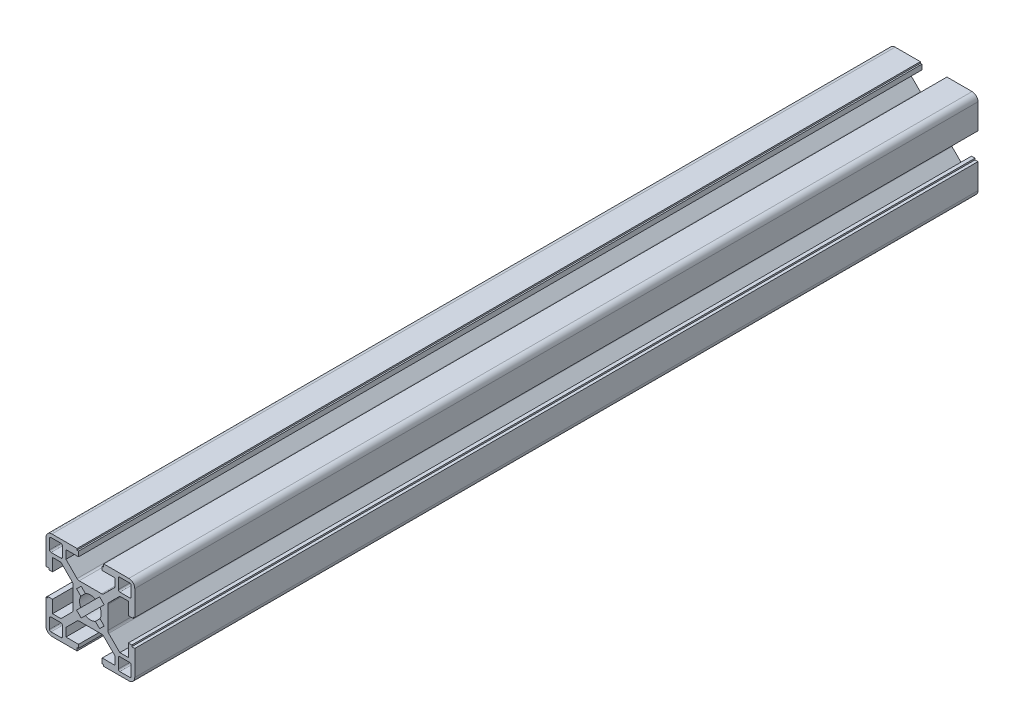
from build123d import *

# Parameters (mm, degrees)
BOSS_EXTRUDE1_DEPTH = 285


with BuildPart() as part:
    # Sketch1 → Boss-Extrude1 (new body)
    with BuildSketch(Plane.XY):
        with BuildLine():
            Line((-4.5, 14.5), (-4.5, 15))
            Line((-4.5, 15), (-13, 15))
            ThreePointArc((-13, 15), (-14.414213562, 14.414213562), (-15, 13))
            Line((-15, 13), (-15, 4.5))
            Line((-15, 4.5), (-14, 4.5))
            Line((-14, 4.5), (-14, 4))
            Line((-14, 4), (-12.8, 4))
            Line((-12.8, 4), (-12.8, 8.25))
            Line((-12.8, 8.25), (-9.95, 8.25))
            Line((-9.95, 8.25), (-6.192893219, 4.492893219))
            ThreePointArc((-6.192893219, 4.492893219), (-5.976120467, 4.16846987), (-5.9, 3.785786438))
            Line((-5.9, 3.785786438), (-5.9, -3.785786438))
            ThreePointArc((-5.9, -3.785786438), (-5.976120467, -4.16846987), (-6.192893219, -4.492893219))
            Line((-6.192893219, -4.492893219), (-9.95, -8.25))
            Line((-9.95, -8.25), (-12.8, -8.25))
            Line((-12.8, -8.25), (-12.8, -4))
            Line((-12.8, -4), (-14.5, -4))
            Line((-14.5, -4), (-14.5, -4.5))
            Line((-14.5, -4.5), (-15, -4.5))
            Line((-15, -4.5), (-15, -13))
            ThreePointArc((-15, -13), (-14.414213562, -14.414213562), (-13, -15))
            Line((-13, -15), (-4.5, -15))
            Line((-4.5, -15), (-4.5, -14))
            Line((-4.5, -14), (-4, -14))
            Line((-4, -14), (-4, -12.8))
            Line((-4, -12.8), (-8.25, -12.8))
            Line((-8.25, -12.8), (-8.25, -9.95))
            Line((-8.25, -9.95), (-4.492893219, -6.192893219))
            ThreePointArc((-4.492893219, -6.192893219), (-4.16846987, -5.976120467), (-3.785786438, -5.9))
            Line((-3.785786438, -5.9), (3.785786438, -5.9))
            ThreePointArc((3.785786438, -5.9), (4.16846987, -5.976120467), (4.492893219, -6.192893219))
            Line((4.492893219, -6.192893219), (8.25, -9.95))
            Line((8.25, -9.95), (8.25, -12.8))
            Line((8.25, -12.8), (4, -12.8))
            Line((4, -12.8), (4, -14.5))
            Line((4, -14.5), (4.5, -14.5))
            Line((4.5, -14.5), (4.5, -15))
            Line((4.5, -15), (13, -15))
            ThreePointArc((13, -15), (14.414213562, -14.414213562), (15, -13))
            Line((15, -13), (15, -4.5))
            Line((15, -4.5), (14, -4.5))
            Line((14, -4.5), (14, -4))
            Line((14, -4), (12.8, -4))
            Line((12.8, -4), (12.8, -8.25))
            Line((12.8, -8.25), (9.95, -8.25))
            Line((9.95, -8.25), (6.192893219, -4.492893219))
            ThreePointArc((6.192893219, -4.492893219), (5.976120467, -4.16846987), (5.9, -3.785786438))
            Line((5.9, -3.785786438), (5.9, 3.785786438))
            ThreePointArc((5.9, 3.785786438), (5.976120467, 4.16846987), (6.192893219, 4.492893219))
            Line((6.192893219, 4.492893219), (9.95, 8.25))
            Line((9.95, 8.25), (12.8, 8.25))
            Line((12.8, 8.25), (12.8, 4))
            Line((12.8, 4), (14.5, 4))
            Line((14.5, 4), (14.5, 4.5))
            Line((14.5, 4.5), (15, 4.5))
            Line((15, 4.5), (15, 13))
            ThreePointArc((15, 13), (14.414213562, 14.414213562), (13, 15))
            Line((13, 15), (4.5, 15))
            Line((4.5, 15), (4.5, 14))
            Line((4.5, 14), (4, 14))
            Line((4, 14), (4, 12.8))
            Line((4, 12.8), (8.25, 12.8))
            Line((8.25, 12.8), (8.25, 9.95))
            Line((8.25, 9.95), (4.492893219, 6.192893219))
            ThreePointArc((4.492893219, 6.192893219), (4.16846987, 5.976120467), (3.785786438, 5.9))
            Line((3.785786438, 5.9), (-3.785786438, 5.9))
            ThreePointArc((-3.785786438, 5.9), (-4.16846987, 5.976120467), (-4.492893219, 6.192893219))
            Line((-4.492893219, 6.192893219), (-8.25, 9.95))
            Line((-8.25, 9.95), (-8.25, 12.8))
            Line((-8.25, 12.8), (-4, 12.8))
            Line((-4, 12.8), (-4, 14.5))
            Line((-4, 14.5), (-4.5, 14.5))
        make_face()
        with BuildLine():
            Line((-9.45, -9.95), (-9.45, -13.3))
            ThreePointArc((-9.45, -13.3), (-9.596446609, -13.653553391), (-9.95, -13.8))
            Line((-9.95, -13.8), (-13.3, -13.8))
            ThreePointArc((-13.3, -13.8), (-13.653553391, -13.653553391), (-13.8, -13.3))
            Line((-13.8, -13.3), (-13.8, -9.95))
            ThreePointArc((-13.8, -9.95), (-13.653553391, -9.596446609), (-13.3, -9.45))
            Line((-13.3, -9.45), (-9.95, -9.45))
            ThreePointArc((-9.95, -9.45), (-9.596446609, -9.596446609), (-9.45, -9.95))
        make_face(mode=Mode.SUBTRACT)
        with BuildLine():
            Line((9.95, -9.45), (13.3, -9.45))
            ThreePointArc((13.3, -9.45), (13.653553391, -9.596446609), (13.8, -9.95))
            Line((13.8, -9.95), (13.8, -13.3))
            ThreePointArc((13.8, -13.3), (13.653553391, -13.653553391), (13.3, -13.8))
            Line((13.3, -13.8), (9.95, -13.8))
            ThreePointArc((9.95, -13.8), (9.596446609, -13.653553391), (9.45, -13.3))
            Line((9.45, -13.3), (9.45, -9.95))
            ThreePointArc((9.45, -9.95), (9.596446609, -9.596446609), (9.95, -9.45))
        make_face(mode=Mode.SUBTRACT)
        with BuildLine():
            Line((-9.95, 9.45), (-13.3, 9.45))
            ThreePointArc((-13.3, 9.45), (-13.653553391, 9.596446609), (-13.8, 9.95))
            Line((-13.8, 9.95), (-13.8, 13.3))
            ThreePointArc((-13.8, 13.3), (-13.653553391, 13.653553391), (-13.3, 13.8))
            Line((-13.3, 13.8), (-9.95, 13.8))
            ThreePointArc((-9.95, 13.8), (-9.596446609, 13.653553391), (-9.45, 13.3))
            Line((-9.45, 13.3), (-9.45, 9.95))
            ThreePointArc((-9.45, 9.95), (-9.596446609, 9.596446609), (-9.95, 9.45))
        make_face(mode=Mode.SUBTRACT)
        with BuildLine():
            ThreePointArc((1.683127481, -3.2387624), (0, -3.65), (-1.683127481, -3.2387624))
            Line((-1.683127481, -3.2387624), (-3.111269837, -4.666904756))
            Line((-3.111269837, -4.666904756), (-4.666904756, -3.111269837))
            Line((-4.666904756, -3.111269837), (-3.2387624, -1.683127481))
            ThreePointArc((-3.2387624, -1.683127481), (-3.65, 0), (-3.2387624, 1.683127481))
            Line((-3.2387624, 1.683127481), (-4.666904756, 3.111269837))
            Line((-4.666904756, 3.111269837), (-3.111269837, 4.666904756))
            Line((-3.111269837, 4.666904756), (-1.683127481, 3.2387624))
            ThreePointArc((-1.683127481, 3.2387624), (0, 3.65), (1.683127481, 3.2387624))
            Line((1.683127481, 3.2387624), (3.111269837, 4.666904756))
            Line((3.111269837, 4.666904756), (4.666904756, 3.111269837))
            Line((4.666904756, 3.111269837), (3.2387624, 1.683127481))
            ThreePointArc((3.2387624, 1.683127481), (3.65, 0), (3.2387624, -1.683127481))
            Line((3.2387624, -1.683127481), (4.666904756, -3.111269837))
            Line((4.666904756, -3.111269837), (3.111269837, -4.666904756))
            Line((3.111269837, -4.666904756), (1.683127481, -3.2387624))
        make_face(mode=Mode.SUBTRACT)
        with BuildLine():
            ThreePointArc((9.45, 13.3), (9.596446609, 13.653553391), (9.95, 13.8))
            Line((9.95, 13.8), (13.3, 13.8))
            ThreePointArc((13.3, 13.8), (13.653553391, 13.653553391), (13.8, 13.3))
            Line((13.8, 13.3), (13.8, 9.95))
            ThreePointArc((13.8, 9.95), (13.653553391, 9.596446609), (13.3, 9.45))
            Line((13.3, 9.45), (9.95, 9.45))
            ThreePointArc((9.95, 9.45), (9.596446609, 9.596446609), (9.45, 9.95))
            Line((9.45, 9.95), (9.45, 13.3))
        make_face(mode=Mode.SUBTRACT)
    extrude(amount=BOSS_EXTRUDE1_DEPTH)


solid = part.part
